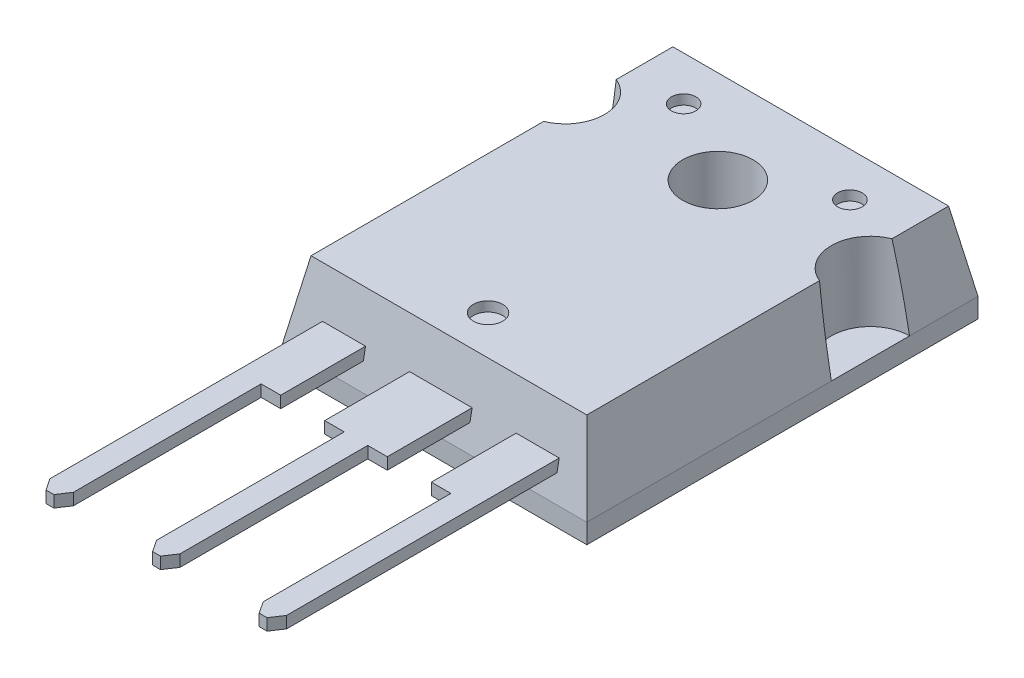
from build123d import *
from OCP.BRepFilletAPI import BRepFilletAPI_MakeChamfer

# Parameters (mm, degrees)
SKETCH1_W                = 15.6
SKETCH1_H                = 5
BOSS_EXTRUDE1_DEPTH      = 20
CHAMFER1_SIZE            = 4
CHAMFER1_SIZE2           = 0.75
SKETCH2_R                = 1.8
CUT_EXTRUDE1_DEPTH       = 23.041778513
SKETCH3_R                = 2
CUT_EXTRUDE2_DEPTH       = 4
SKETCH4_R                = 0.625
CUT_EXTRUDE3_DEPTH       = 0.5
SKETCH5_R                = 0.75
CUT_EXTRUDE4_DEPTH       = 0.5
BOSS_EXTRUDE2_DEPTH      = 0.3
BOSS_EXTRUDE2_DEPTH_BACK = 0.3


with BuildPart() as part:
    # Sketch1 → Boss-Extrude1 (new body)
    with BuildSketch(Plane.XY):
        Rectangle(SKETCH1_W, SKETCH1_H)
    extrude(amount=BOSS_EXTRUDE1_DEPTH)

    # Chamfer1: one chamfer whose edges measure the first distance from different faces: ONE call of the kernel's chamfer builder (chamfer() names one face for all edges)
    chamfer1_edges_1 = [part.edges().sort_by_distance(p)[0] for p in [
        (0, 2.5, 20),
    ]]
    chamfer1_side_1 = [part.faces().sort_by_distance(p)[0] for p in [
        (0, 0, 20),
    ]]
    chamfer1_edges_2 = [part.edges().sort_by_distance(p)[0] for p in [
        (0, 2.5, 0),
    ]]
    chamfer1_side_2 = [part.faces().sort_by_distance(p)[0] for p in [
        (0, 0, 0),
    ]]
    chamfer1_edges_3 = [part.edges().sort_by_distance(p)[0] for p in [
        (-7.8, 2.5, 10),
    ]]
    chamfer1_side_3 = [part.faces().sort_by_distance(p)[0] for p in [
        (-7.8, 0, 10),
    ]]
    chamfer1_edges_4 = [part.edges().sort_by_distance(p)[0] for p in [
        (7.8, 2.5, 10),
    ]]
    chamfer1_side_4 = [part.faces().sort_by_distance(p)[0] for p in [
        (7.8, 0, 10),
    ]]
    chamfer1 = BRepFilletAPI_MakeChamfer(part.part.solid().wrapped)
    for e in chamfer1_edges_1:
        chamfer1.Add(CHAMFER1_SIZE, CHAMFER1_SIZE2, e.wrapped, chamfer1_side_1[0].wrapped)  # the first distance lies on this face
    for e in chamfer1_edges_2:
        chamfer1.Add(CHAMFER1_SIZE, CHAMFER1_SIZE2, e.wrapped, chamfer1_side_2[0].wrapped)  # the first distance lies on this face
    for e in chamfer1_edges_3:
        chamfer1.Add(CHAMFER1_SIZE, CHAMFER1_SIZE2, e.wrapped, chamfer1_side_3[0].wrapped)  # the first distance lies on this face
    for e in chamfer1_edges_4:
        chamfer1.Add(CHAMFER1_SIZE, CHAMFER1_SIZE2, e.wrapped, chamfer1_side_4[0].wrapped)  # the first distance lies on this face
    add(Compound.cast(chamfer1.Shape()), mode=Mode.REPLACE)

    # Sketch2 → Cut-Extrude1 (cut, through all)
    with BuildSketch(Plane(origin=(0, 2.5, 0), x_dir=(1, 0, 0), z_dir=(0, 1, 0))):
        with Locations(Location((0, -5.5, 0), (0, 0, 270))):
            Circle(SKETCH2_R)
    extrude(amount=-CUT_EXTRUDE1_DEPTH, mode=Mode.SUBTRACT)

    # Sketch3 → Cut-Extrude2 (cut)
    with BuildSketch(Plane(origin=(0, 2.5, 0), x_dir=(1, 0, 0), z_dir=(0, 1, 0))):
        with Locations((-7.8, -5.5)):
            Circle(SKETCH3_R)
        with Locations((7.8, -5.5)):
            Circle(SKETCH3_R)
    extrude(amount=-CUT_EXTRUDE2_DEPTH, mode=Mode.SUBTRACT)

    # Sketch4 → Cut-Extrude3 (cut)
    with BuildSketch(Plane(origin=(0, 2.5, 0), x_dir=(1, 0, 0), z_dir=(0, 1, 0))):
        with Locations(Location((4.25, -3, 0), (0, 0, 270))):
            Circle(SKETCH4_R)
        with Locations(Location((-4.25, -3, 0), (0, 0, 90))):
            Circle(SKETCH4_R)
    extrude(amount=-CUT_EXTRUDE3_DEPTH, mode=Mode.SUBTRACT)

    # Sketch5 → Cut-Extrude4 (cut)
    with BuildSketch(Plane(origin=(0, 2.5, 0), x_dir=(1, 0, 0), z_dir=(0, 1, 0))):
        with Locations(Location((0, -17.25, 0), (0, 0, 270))):
            Circle(SKETCH5_R)
    extrude(amount=-CUT_EXTRUDE4_DEPTH, mode=Mode.SUBTRACT)

    # Sketch6 → Boss-Extrude2 (add, two sides: drawn at the far end of the back side and taken through both)
    with BuildSketch(Plane(origin=(0, 0, 0), x_dir=(-1, 0, 0), z_dir=(0, -1, 0)).offset(-BOSS_EXTRUDE2_DEPTH_BACK)):
        Polygon((6.05, -24), (4.85, -24), (4.85, -33.6), (5.25, -34.2), (5.65, -34.2), (6.05, -33.6), align=None)
        Polygon((6.05, -19.25), (3.85, -19.25), (3.85, -20), (3.85, -24), (4.85, -24), (6.05, -24), (6.05, -20), align=None)
        Polygon((-1.6, -19.25), (-1.6, -24), (-0.6, -24), (0, -24), (0.6, -24), (1.6, -24), (1.6, -19.25), align=None)
        Polygon((-6.05, -20), (-6.05, -24), (-4.85, -24), (-3.85, -24), (-3.85, -20), (-3.85, -19.25), (-6.05, -19.25), align=None)
        Polygon((0.6, -24), (0, -24), (0, -34.2), (0.2, -34.2), (0.6, -33.6), align=None)
        Polygon((0, -24), (-0.6, -24), (-0.6, -33.6), (-0.2, -34.2), (0, -34.2), align=None)
        Polygon((-4.85, -24), (-6.05, -24), (-6.05, -33.6), (-5.65, -34.2), (-5.25, -34.2), (-4.85, -33.6), align=None)
    extrude(amount=BOSS_EXTRUDE2_DEPTH + BOSS_EXTRUDE2_DEPTH_BACK)


solid = part.part
